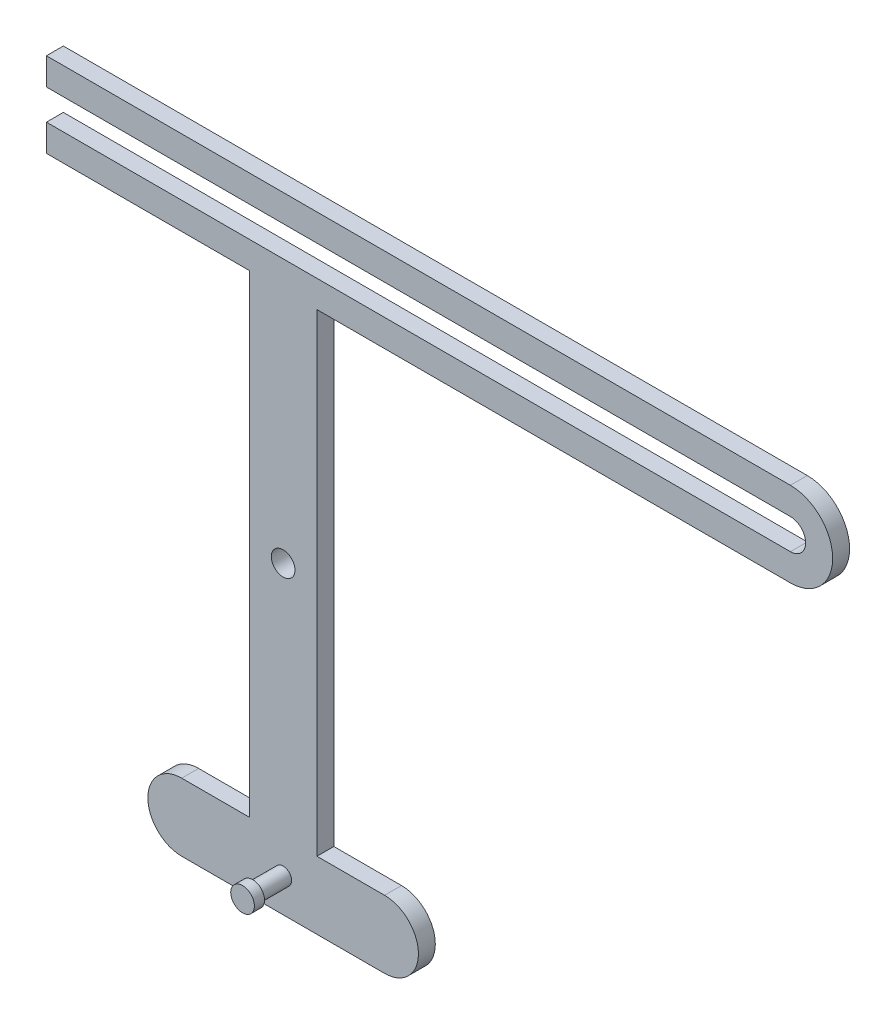
from build123d import *

# Parameters (mm, degrees)
BOSS_EXTRUDE1_DEPTH = 3.175
SKETCH4_W           = 25.4
SKETCH4_H           = 177.8
BOSS_EXTRUDE2_DEPTH = 3.175
BOSS_EXTRUDE3_DEPTH = 3.175
CUT_EXTRUDE1_DEPTH  = 304.357916701
SKETCH7_R           = 4.445
CUT_EXTRUDE2_DEPTH  = 304.357916701
SKETCH9_R           = 3.175
BOSS_EXTRUDE6_DEPTH = 15.24
SKETCH10_R          = 4.445
BOSS_EXTRUDE7_DEPTH = 3.81


with BuildPart() as part:
    # Sketch3 → Boss-Extrude1 (new, symmetric)
    with BuildSketch(Plane.XY):
        with BuildLine():
            Line((-38.1, 12.7), (38.1, 12.7))
            ThreePointArc((38.1, 12.7), (50.8, 0), (38.1, -12.7))
            Line((38.1, -12.7), (-38.1, -12.7))
            ThreePointArc((-38.1, -12.7), (-50.8, 0), (-38.1, 12.7))
        make_face()
    extrude(amount=BOSS_EXTRUDE1_DEPTH, both=True)

    # Sketch4 → Boss-Extrude2 (add, symmetric)
    with BuildSketch(Plane.XY):
        with Locations((0, 101.6)):
            Rectangle(SKETCH4_W, SKETCH4_H)
    extrude(amount=BOSS_EXTRUDE2_DEPTH, both=True)

    # Sketch5 → Boss-Extrude3 (add, symmetric)
    with BuildSketch(Plane.XY):
        with BuildLine():
            Line((-88.9, 222.25), (190.5, 222.25))
            ThreePointArc((190.5, 222.25), (206.375, 206.375), (190.5, 190.5))
            Line((190.5, 190.5), (-88.9, 190.5))
            Line((-88.9, 190.5), (-88.9, 222.25))
        make_face()
    extrude(amount=BOSS_EXTRUDE3_DEPTH, both=True)

    # Sketch6 → Cut-Extrude1 (cut, through all)
    with BuildSketch(Plane.XY.offset(3.175)):
        with BuildLine():
            Line((-88.9, 212.09), (-88.9, 200.66))
            Line((-88.9, 200.66), (190.5, 200.66))
            ThreePointArc((190.5, 200.66), (196.215, 206.375), (190.5, 212.09))
            Line((190.5, 212.09), (-88.9, 212.09))
        make_face()
    extrude(amount=-CUT_EXTRUDE1_DEPTH, mode=Mode.SUBTRACT)

    # Sketch7 → Cut-Extrude2 (cut, through all)
    with BuildSketch(Plane.XY.offset(3.175)):
        with Locations((0, 101.6)):
            Circle(SKETCH7_R)
    extrude(amount=-CUT_EXTRUDE2_DEPTH, mode=Mode.SUBTRACT)

    # Sketch9 → Boss-Extrude6 (add)
    with BuildSketch(Plane.XY.offset(3.175)):
        with Locations(Location((0, 0, 0), (0, 0, 180))):
            Circle(SKETCH9_R)
    extrude(amount=BOSS_EXTRUDE6_DEPTH)

    # Sketch10 → Boss-Extrude7 (add)
    with BuildSketch(Plane.XY.offset(18.415)):
        Circle(SKETCH10_R)
    extrude(amount=-BOSS_EXTRUDE7_DEPTH)


solid = part.part
